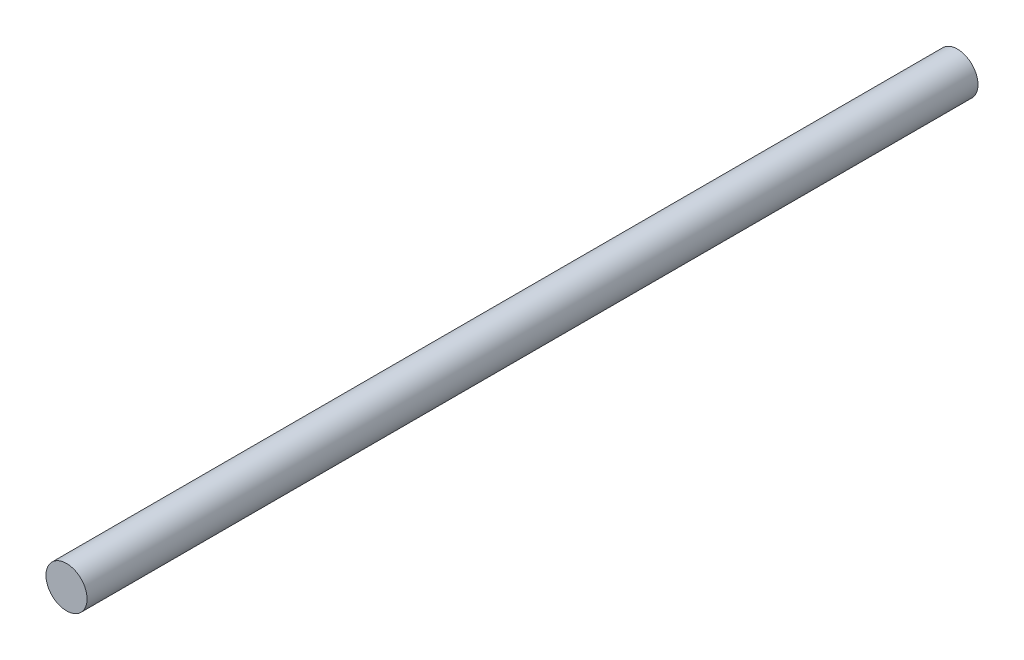
from build123d import *

# Parameters (mm, degrees)
SKETCH1_R           = 7.62
BOSS_EXTRUDE1_DEPTH = 330.2


with BuildPart() as part:
    # Sketch1 → Boss-Extrude1 (new body)
    with BuildSketch(Plane.XY):
        Circle(SKETCH1_R)
    extrude(amount=BOSS_EXTRUDE1_DEPTH)


solid = part.part
